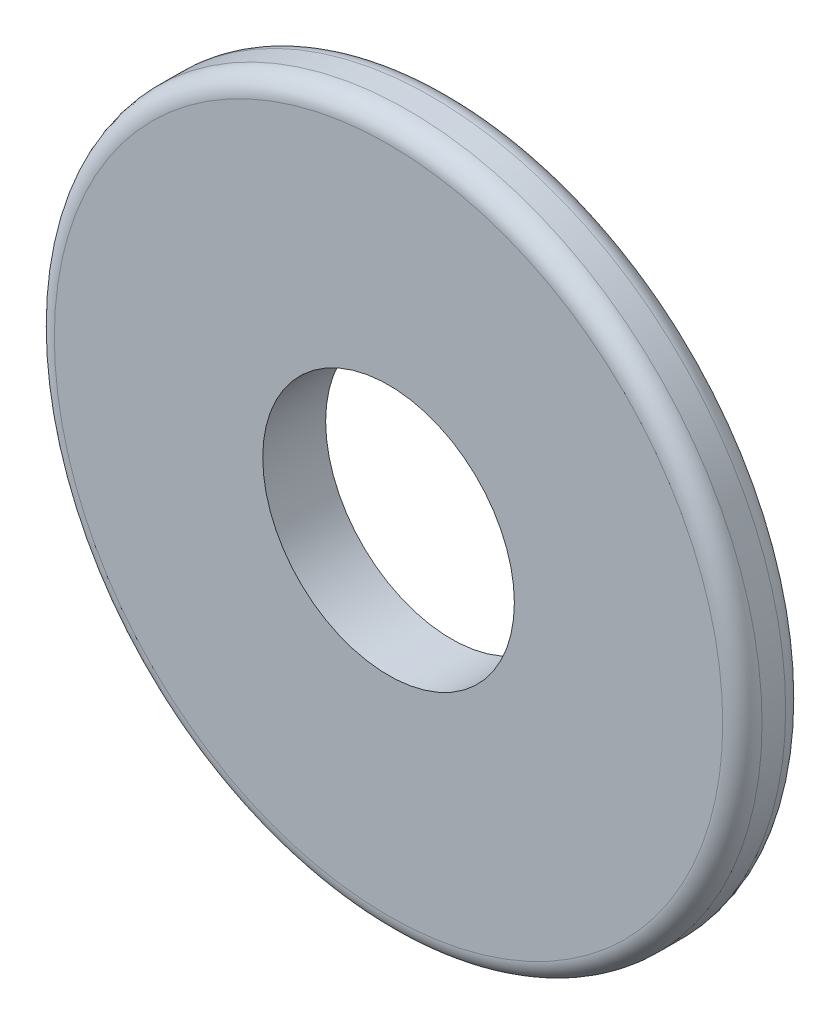
from build123d import *

# Parameters (mm, degrees)
SKETCH_1_R          = 9
EXTRUDE_1_DEPTH     = 1.6
SKETCH_2_R          = 3.2
CUT_EXTRUDE_1_DEPTH = 1.6
FILLET_1_R          = 0.5


with BuildPart() as part:
    # Эскиз1 → Бобышка-Вытянуть1 (new body)
    with BuildSketch(Plane.XY):
        Circle(SKETCH_1_R)
    extrude(amount=EXTRUDE_1_DEPTH)

    # Эскиз2 → Вырез-Вытянуть1 (cut)
    with BuildSketch(Plane.XY.offset(1.6)):
        Circle(SKETCH_2_R)
    extrude(amount=-CUT_EXTRUDE_1_DEPTH, mode=Mode.SUBTRACT)

    # Скругление1
    fillet_1_edges = [part.edges().sort_by_distance(p)[0] for p in [
        (-9, 0, 0),
        (-9, 0, 1.6),
    ]]
    fillet(fillet_1_edges, radius=FILLET_1_R)


solid = part.part
